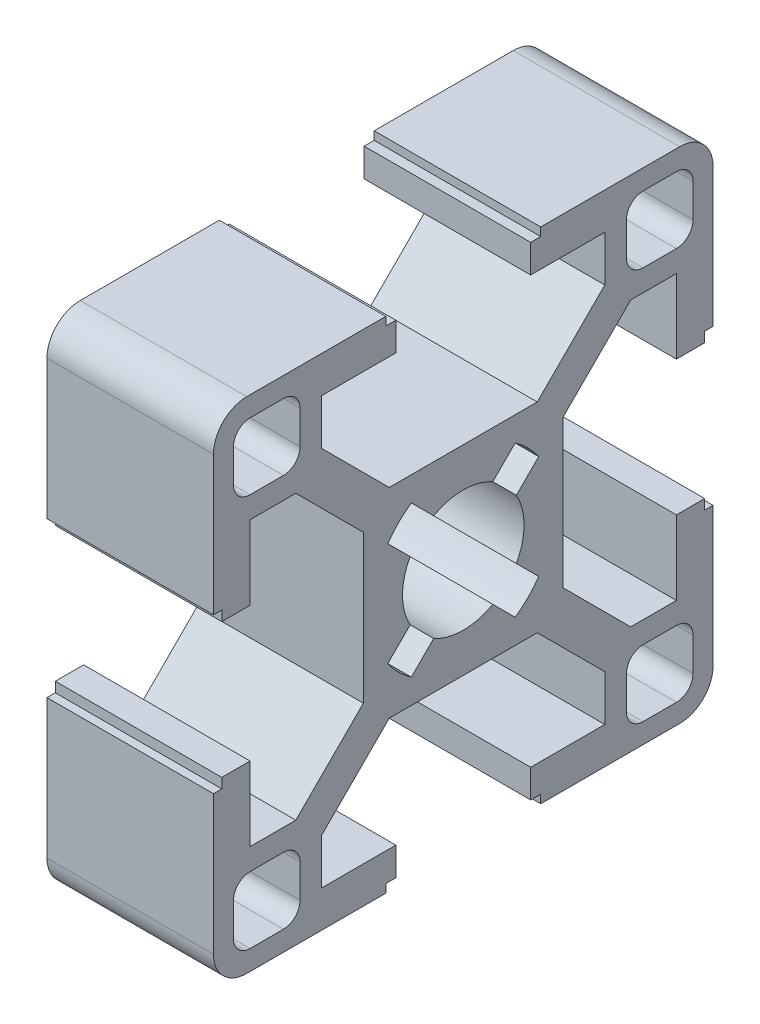
from build123d import *

# Parameters (mm, degrees)
AUFSATZ_LINEAR_AUSTRAGEN1_DEPTH = 10


with BuildPart() as part:
    # Skizze1 → Aufsatz-Linear austragen1 (new body)
    with BuildSketch(Plane(origin=(0, 0, 0), x_dir=(0, 0, -1), z_dir=(1, 0, 0))):
        with BuildLine():
            Line((10.055634919, 8.5), (12.8, 8.5))
            Line((12.8, 8.5), (12.8, 4.05))
            Line((12.8, 4.05), (14.5, 4.05))
            Line((14.5, 4.05), (14.5, 4.651637069))
            Line((14.5, 4.651637069), (15, 4.651637069))
            Line((15, 4.651637069), (15, 13))
            ThreePointArc((15, 13), (14.414213562, 14.414213562), (13, 15))
            Line((13, 15), (4.651637069, 15))
            Line((4.651637069, 15), (4.651637069, 14.5))
            Line((4.651637069, 14.5), (4.05, 14.5))
            Line((4.05, 14.5), (4.05, 12.8))
            Line((4.05, 12.8), (8.5, 12.8))
            Line((8.5, 12.8), (8.5, 10.055634919))
            Line((8.5, 10.055634919), (4.444365081, 6))
            Line((4.444365081, 6), (-4.444365081, 6))
            Line((-4.444365081, 6), (-8.5, 10.055634919))
            Line((-8.5, 10.055634919), (-8.5, 12.8))
            Line((-8.5, 12.8), (-4.05, 12.8))
            Line((-4.05, 12.8), (-4.05, 14.5))
            Line((-4.05, 14.5), (-4.651637069, 14.5))
            Line((-4.651637069, 14.5), (-4.651637069, 15))
            Line((-4.651637069, 15), (-13, 15))
            ThreePointArc((-13, 15), (-14.414213562, 14.414213562), (-15, 13))
            Line((-15, 13), (-15, 4.651637069))
            Line((-15, 4.651637069), (-14.5, 4.651637069))
            Line((-14.5, 4.651637069), (-14.5, 4.05))
            Line((-14.5, 4.05), (-12.8, 4.05))
            Line((-12.8, 4.05), (-12.8, 8.5))
            Line((-12.8, 8.5), (-10.055634919, 8.5))
            Line((-10.055634919, 8.5), (-6, 4.444365081))
            Line((-6, 4.444365081), (-6, -4.444365081))
            Line((-6, -4.444365081), (-10.055634919, -8.5))
            Line((-10.055634919, -8.5), (-12.8, -8.5))
            Line((-12.8, -8.5), (-12.8, -4.05))
            Line((-12.8, -4.05), (-14.5, -4.05))
            Line((-14.5, -4.05), (-14.5, -4.651637069))
            Line((-14.5, -4.651637069), (-15, -4.651637069))
            Line((-15, -4.651637069), (-15, -13))
            ThreePointArc((-15, -13), (-14.414213562, -14.414213562), (-13, -15))
            Line((-13, -15), (-4.651637069, -15))
            Line((-4.651637069, -15), (-4.651637069, -14.5))
            Line((-4.651637069, -14.5), (-4.05, -14.5))
            Line((-4.05, -14.5), (-4.05, -12.8))
            Line((-4.05, -12.8), (-8.5, -12.8))
            Line((-8.5, -12.8), (-8.5, -10.055634919))
            Line((-8.5, -10.055634919), (-4.444365081, -6))
            Line((-4.444365081, -6), (4.444365081, -6))
            Line((4.444365081, -6), (8.5, -10.055634919))
            Line((8.5, -10.055634919), (8.5, -12.8))
            Line((8.5, -12.8), (4.05, -12.8))
            Line((4.05, -12.8), (4.05, -14.5))
            Line((4.05, -14.5), (4.651637069, -14.5))
            Line((4.651637069, -14.5), (4.651637069, -15))
            Line((4.651637069, -15), (13, -15))
            ThreePointArc((13, -15), (14.414213562, -14.414213562), (15, -13))
            Line((15, -13), (15, -4.651637069))
            Line((15, -4.651637069), (14.5, -4.651637069))
            Line((14.5, -4.651637069), (14.5, -4.05))
            Line((14.5, -4.05), (12.8, -4.05))
            Line((12.8, -4.05), (12.8, -8.5))
            Line((12.8, -8.5), (10.055634919, -8.5))
            Line((10.055634919, -8.5), (6, -4.444365081))
            Line((6, -4.444365081), (6, 4.444365081))
            Line((6, 4.444365081), (10.055634919, 8.5))
        make_face()
        with BuildLine():
            ThreePointArc((12.8, 13.8), (13.507106781, 13.507106781), (13.8, 12.8))
            Line((13.8, 12.8), (13.8, 10.8))
            ThreePointArc((13.8, 10.8), (13.507106781, 10.092893219), (12.8, 9.8))
            Line((12.8, 9.8), (10.8, 9.8))
            ThreePointArc((10.8, 9.8), (10.092893219, 10.092893219), (9.8, 10.8))
            Line((9.8, 10.8), (9.8, 12.8))
            ThreePointArc((9.8, 12.8), (10.092893219, 13.507106781), (10.8, 13.8))
            Line((10.8, 13.8), (12.8, 13.8))
        make_face(mode=Mode.SUBTRACT)
        with BuildLine():
            Line((-3.117157854, 4.531371416), (-1.775079755, 3.189293317))
            ThreePointArc((-1.775079755, 3.189293317), (0, 3.65), (1.775079755, 3.189293317))
            Line((1.775079755, 3.189293317), (3.117157854, 4.531371416))
            ThreePointArc((3.117157854, 4.531371416), (3.889087297, 3.889087297), (4.531371416, 3.117157854))
            Line((4.531371416, 3.117157854), (3.189293317, 1.775079755))
            ThreePointArc((3.189293317, 1.775079755), (3.65, 0), (3.189293317, -1.775079755))
            Line((3.189293317, -1.775079755), (4.531371416, -3.117157854))
            ThreePointArc((4.531371416, -3.117157854), (3.889087297, -3.889087297), (3.117157854, -4.531371416))
            Line((3.117157854, -4.531371416), (1.775079755, -3.189293317))
            ThreePointArc((1.775079755, -3.189293317), (0, -3.65), (-1.775079755, -3.189293317))
            Line((-1.775079755, -3.189293317), (-3.117157854, -4.531371416))
            ThreePointArc((-3.117157854, -4.531371416), (-3.889087297, -3.889087297), (-4.531371416, -3.117157854))
            Line((-4.531371416, -3.117157854), (-3.189293317, -1.775079755))
            ThreePointArc((-3.189293317, -1.775079755), (-3.65, 0), (-3.189293317, 1.775079755))
            Line((-3.189293317, 1.775079755), (-4.531371416, 3.117157854))
            ThreePointArc((-4.531371416, 3.117157854), (-3.889087297, 3.889087297), (-3.117157854, 4.531371416))
        make_face(mode=Mode.SUBTRACT)
        with BuildLine():
            ThreePointArc((-13.8, 12.8), (-13.507106781, 13.507106781), (-12.8, 13.8))
            Line((-12.8, 13.8), (-10.8, 13.8))
            ThreePointArc((-10.8, 13.8), (-10.092893219, 13.507106781), (-9.8, 12.8))
            Line((-9.8, 12.8), (-9.8, 10.8))
            ThreePointArc((-9.8, 10.8), (-10.092893219, 10.092893219), (-10.8, 9.8))
            Line((-10.8, 9.8), (-12.8, 9.8))
            ThreePointArc((-12.8, 9.8), (-13.507106781, 10.092893219), (-13.8, 10.8))
            Line((-13.8, 10.8), (-13.8, 12.8))
        make_face(mode=Mode.SUBTRACT)
        with BuildLine():
            ThreePointArc((9.8, -10.8), (10.092893219, -10.092893219), (10.8, -9.8))
            Line((10.8, -9.8), (12.8, -9.8))
            ThreePointArc((12.8, -9.8), (13.507106781, -10.092893219), (13.8, -10.8))
            Line((13.8, -10.8), (13.8, -12.8))
            ThreePointArc((13.8, -12.8), (13.507106781, -13.507106781), (12.8, -13.8))
            Line((12.8, -13.8), (10.8, -13.8))
            ThreePointArc((10.8, -13.8), (10.092893219, -13.507106781), (9.8, -12.8))
            Line((9.8, -12.8), (9.8, -10.8))
        make_face(mode=Mode.SUBTRACT)
        with BuildLine():
            Line((-9.8, -10.8), (-9.8, -12.8))
            ThreePointArc((-9.8, -12.8), (-10.092893219, -13.507106781), (-10.8, -13.8))
            Line((-10.8, -13.8), (-12.8, -13.8))
            ThreePointArc((-12.8, -13.8), (-13.507106781, -13.507106781), (-13.8, -12.8))
            Line((-13.8, -12.8), (-13.8, -10.8))
            ThreePointArc((-13.8, -10.8), (-13.507106781, -10.092893219), (-12.8, -9.8))
            Line((-12.8, -9.8), (-10.8, -9.8))
            ThreePointArc((-10.8, -9.8), (-10.092893219, -10.092893219), (-9.8, -10.8))
        make_face(mode=Mode.SUBTRACT)
    extrude(amount=AUFSATZ_LINEAR_AUSTRAGEN1_DEPTH)


solid = part.part
